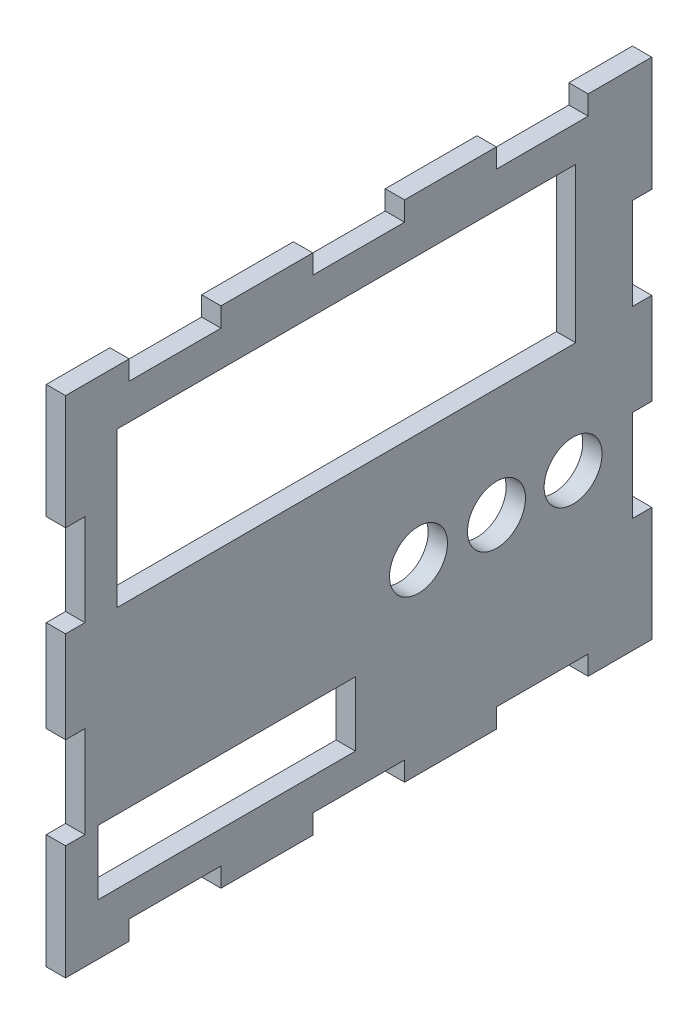
from build123d import *

# Parameters (mm, degrees)
BOSS_EXTRUDE1_DEPTH = 3
SKETCH2_R           = 4.5
SKETCH2_W           = 71.2
SKETCH2_H           = 24
SKETCH2_W_2         = 40
SKETCH2_H_2         = 10
CUT_EXTRUDE1_DEPTH  = 3


with BuildPart() as part:
    # Sketch1 → Boss-Extrude1 (new body)
    with BuildSketch(Plane(origin=(0, 0, 0), x_dir=(0, 0, -1), z_dir=(1, 0, 0))):
        Polygon((-46.800460417, 37.069263333), (-46.800460417, 19.294263333), (-43.800460417, 19.294263333), (-43.800460417, 5.044263333), (-46.800460417, 5.044263333), (-46.800460417, -9.205736667), (-43.800460417, -9.205736667), (-43.800460417, -23.455736667), (-46.800460417, -23.455736667), (-46.800460417, -37.705736667), (-46.800460417, -41.230736667), (-36.925460417, -41.230736667), (-36.925460417, -38.230736667), (-22.675460417, -38.230736667), (-22.675460417, -41.230736667), (-8.425460417, -41.230736667), (-8.425460417, -38.230736667), (5.824539583, -38.230736667), (5.824539583, -41.230736667), (20.074539583, -41.230736667), (20.074539583, -38.230736667), (34.324539583, -38.230736667), (34.324539583, -41.230736667), (44.199539583, -41.230736667), (44.199539583, -23.455736667), (41.199539583, -23.455736667), (41.199539583, -9.205736667), (44.199539583, -9.205736667), (44.199539583, 5.044263333), (41.199539583, 5.044263333), (41.199539583, 19.294263333), (44.199539583, 19.294263333), (44.199539583, 33.544263333), (44.199539583, 37.069263333), (34.324539583, 37.069263333), (34.324539583, 34.069263333), (20.074539583, 34.069263333), (20.074539583, 37.069263333), (5.824539583, 37.069263333), (5.824539583, 34.069263333), (-8.425460417, 34.069263333), (-8.425460417, 37.069263333), (-22.675460417, 37.069263333), (-22.675460417, 34.069263333), (-36.925460417, 34.069263333), (-36.925460417, 37.069263333), align=None)
    extrude(amount=BOSS_EXTRUDE1_DEPTH)

    # Sketch2 → Cut-Extrude1 (cut)
    with BuildSketch(Plane(origin=(3, 0, 0), x_dir=(0, 0, -1), z_dir=(1, 0, 0))):
        with Locations((20.094295928, -12.405736667)):
            Circle(SKETCH2_R)
        with Locations((7.989052272, -12.405736667)):
            Circle(SKETCH2_R)
        with Locations(Location((31.989052272, -12.405736667, 0), (0, 0, 180))):
            Circle(SKETCH2_R)
        with Locations((-3.200460417, 16.569263333)):
            Rectangle(SKETCH2_W, SKETCH2_H)
        with Locations((-21.800460417, -28.230736667)):
            Rectangle(SKETCH2_W_2, SKETCH2_H_2)
    extrude(amount=-CUT_EXTRUDE1_DEPTH, mode=Mode.SUBTRACT)


solid = part.part
